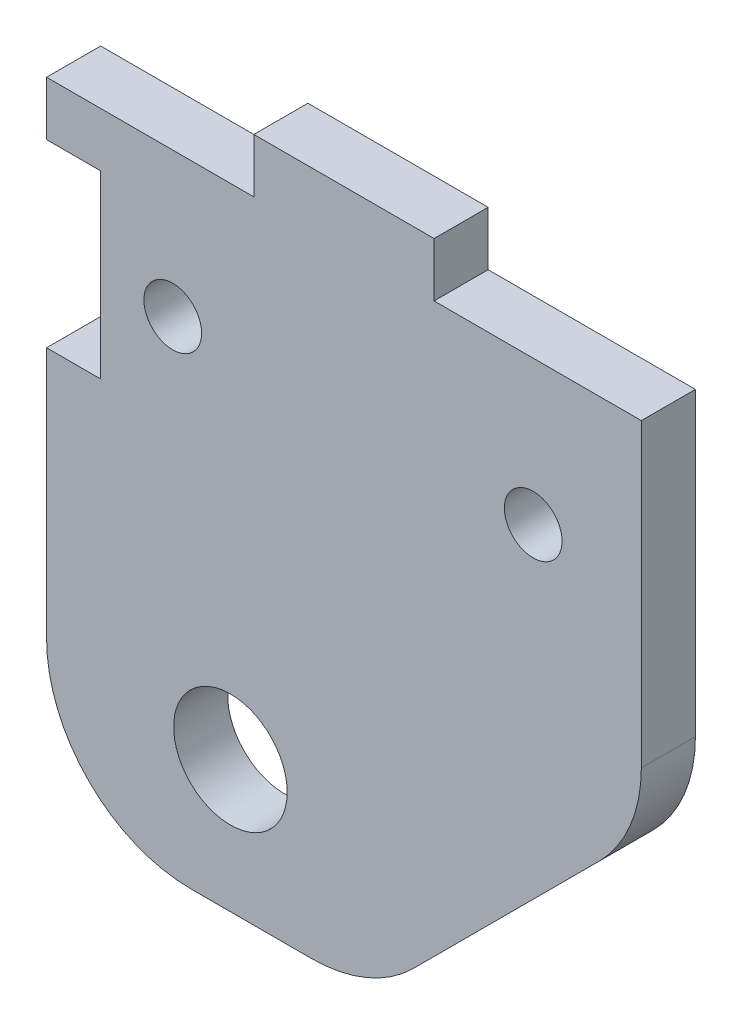
from build123d import *

# Parameters (mm, degrees)
ESBO_O1_R                = 1.6
ESBO_O1_R_2              = 3.15
RESSALTO_EXTRUS_O1_DEPTH = 3
CHANFRO2_SIZE            = 15
FILETE2_R                = 8


with BuildPart() as part:
    # Esboço1 → Ressalto-extrusão1 (new body)
    with BuildSketch(Plane.XY):
        Polygon((11.5, 0), (0, 0), (0, -3), (3, -3), (3, -13), (0, -13), (0, -35), (33, -35), (33, 0), (21.5, 0), (21.5, 3), (11.5, 3), align=None)
        with Locations((27, -8)):
            Circle(ESBO_O1_R, mode=Mode.SUBTRACT)
        with Locations((7, -8)):
            Circle(ESBO_O1_R, mode=Mode.SUBTRACT)
        with Locations((10.2, -27.684295139)):
            Circle(ESBO_O1_R_2, mode=Mode.SUBTRACT)
    extrude(amount=RESSALTO_EXTRUS_O1_DEPTH)

    # Chanfro2
    chanfro2_edges = [part.edges().sort_by_distance(p)[0] for p in [
        (33, -35, 1.5),
    ]]
    chamfer(chanfro2_edges, length=CHANFRO2_SIZE)

    # Filete2
    filete2_edges = [part.edges().sort_by_distance(p)[0] for p in [
        (0, -35, 1.5),
        (33, -20, 1.5),
        (18, -35, 1.5),
    ]]
    fillet(filete2_edges, radius=FILETE2_R)


solid = part.part
